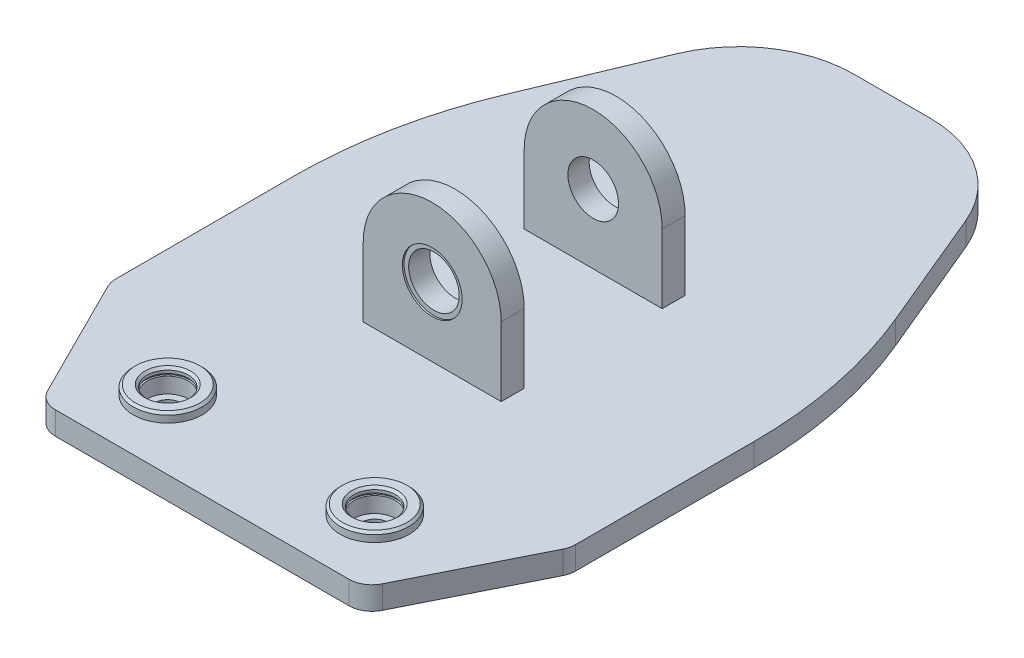
from build123d import *

# Parameters (mm, degrees)
EXTRUDE_1_DEPTH            = 10
EXTRUDE_START              = -100
EXTRUDE_3_DEPTH            = 80
SKETCH_5_W                 = 80
SKETCH_5_H                 = 60
CUT_EXTRUDE_2_DEPTH        = 110
FILLET_1_R                 = 50
FILLET_2_R                 = 200
SKETCH_7_R                 = 9
CUT_EXTRUDE_6_DEPTH        = 6
SKETCH_10_R                = 6
CUT_EXTRUDE_7_DEPTH        = 28
SKETCH_12_R                = 15
EXTRUDE_5_DEPTH            = 4
SKETCH_13_R                = 9
CUT_EXTRUDE_9_DEPTH        = 4
CUT_EXTRUDE_START          = -2.25
SKETCH_14_R                = 9.75
CUT_EXTRUDE_4141_DEPTH     = 1
CHAMFER_1_SIZE             = 1
CHAMFER_1_OF_MIRROR_1_SIZE = 1
SKETCH_16_R                = 13
CUT_EXTRUDE_10_DEPTH       = 0.75
CUT_EXTRUDE_START_2        = -0.75
SKETCH_17_R                = 13
CUT_EXTRUDE_11_DEPTH       = 0.75
CHAMFER_2_SIZE             = 30
CHAMFER_2_SIZE2            = 60
CHAMFER_3_SIZE             = 60
CHAMFER_3_SIZE2            = 30
FILLET_3_R                 = 10


with BuildPart() as part:
    # 草图1 → 凸台-拉伸1 (new body)
    with BuildSketch(Plane(origin=(0, 0, 0), x_dir=(1, 0, 0), z_dir=(0, 1, 0))):
        Polygon((-100, 0), (100, 0), (100, 180), (50, 300), (-50, 300), (-100, 180), align=None)
    extrude(amount=EXTRUDE_1_DEPTH)

    # 草图4 → 凸台-拉伸3 (add)
    with BuildSketch(Plane.XY.offset(EXTRUDE_START)):
        with BuildLine():
            Line((0, 29), (0, 10))
            Line((0, 10), (30, 10))
            Line((30, 10), (30, 40))
            ThreePointArc((30, 40), (21.213203436, 61.213203436), (0, 70))
            Line((0, 70), (0, 51))
            ThreePointArc((0, 51), (7.778174593, 47.778174593), (11, 40))
            ThreePointArc((11, 40), (7.778174593, 32.221825407), (0, 29))
        make_face()
        with BuildLine():
            Line((-30, 10), (0, 10))
            Line((0, 10), (0, 29))
            ThreePointArc((0, 29), (-11, 40), (0, 51))
            Line((0, 51), (0, 70))
            ThreePointArc((0, 70), (-21.213203436, 61.213203436), (-30, 40))
            Line((-30, 40), (-30, 10))
        make_face()
    extrude(amount=-EXTRUDE_3_DEPTH)

    # 草图5 → 切除-拉伸2 (cut)
    with BuildSketch(Plane(origin=(0, 10, 0), x_dir=(1, 0, 0), z_dir=(0, 1, 0))):
        with Locations((0, 140)):
            Rectangle(SKETCH_5_W, SKETCH_5_H)
    extrude(amount=CUT_EXTRUDE_2_DEPTH, mode=Mode.SUBTRACT)

    # 圆角1
    fillet_1_edges = [part.edges().sort_by_distance(p)[0] for p in [
        (-50, 5, -300),
        (50, 5, -300),
    ]]
    fillet(fillet_1_edges, radius=FILLET_1_R)

    # 圆角2
    fillet_2_edges = [part.edges().sort_by_distance(p)[0] for p in [
        (-100, 5, -180),
        (100, 5, -180),
    ]]
    fillet(fillet_2_edges, radius=FILLET_2_R)

    # 草图7 → 切除-拉伸6 (cut)
    with BuildSketch(Plane(origin=(0, 10, 0), x_dir=(1, 0, 0), z_dir=(0, 1, 0))):
        with Locations(Location((45, 30, 0), (0, 0, 270))):
            Circle(SKETCH_7_R)
    cut_extrude_6 = extrude(amount=-CUT_EXTRUDE_6_DEPTH, mode=Mode.SUBTRACT)

    # 草图10 → 切除-拉伸7 (cut)
    with BuildSketch(Plane(origin=(0, 4, 0), x_dir=(1, 0, 0), z_dir=(0, 1, 0))):
        with Locations(Location((45, 30, 0), (0, 0, 270))):
            Circle(SKETCH_10_R)
    cut_extrude_7 = extrude(amount=-CUT_EXTRUDE_7_DEPTH, mode=Mode.SUBTRACT)

    # 草图12 → 凸台-拉伸5 (add)
    with BuildSketch(Plane(origin=(0, 10, 0), x_dir=(1, 0, 0), z_dir=(0, 1, 0))):
        with Locations(Location((45, 30, 0), (0, 0, 270))):
            Circle(SKETCH_12_R)
    extrude_5 = extrude(amount=EXTRUDE_5_DEPTH)

    # 草图13 → 切除-拉伸9 (cut)
    with BuildSketch(Plane(origin=(0, 14, 0), x_dir=(1, 0, 0), z_dir=(0, 1, 0))):
        with Locations(Location((45, 30, 0), (0, 0, 270))):
            Circle(SKETCH_13_R)
    cut_extrude_9 = extrude(amount=-CUT_EXTRUDE_9_DEPTH, mode=Mode.SUBTRACT)

    # 草图14 → Cut-Extrude 4141 (cut)
    with BuildSketch(Plane(origin=(0, 14, 0), x_dir=(1, 0, 0), z_dir=(0, 1, 0)).offset(CUT_EXTRUDE_START)):
        with Locations(Location((45, 30, 0), (0, 0, 270))):
            Circle(SKETCH_14_R)
    cut_extrude_4141 = extrude(amount=-CUT_EXTRUDE_4141_DEPTH, mode=Mode.SUBTRACT)

    # 倒角1
    chamfer_1_edges = [part.edges().sort_by_distance(p)[0] for p in [
        (45, 14, -45),
        (45, 14, -39),
    ]]
    chamfer(chamfer_1_edges, length=CHAMFER_1_SIZE)

    # 镜向1: 切除-拉伸6, 切除-拉伸7, 凸台-拉伸5, 切除-拉伸9, Cut-Extrude 4141 across plane
    add(cut_extrude_6.mirror(Plane.ZY), mode=Mode.SUBTRACT)
    add(cut_extrude_7.mirror(Plane.ZY), mode=Mode.SUBTRACT)
    add(extrude_5.mirror(Plane.ZY))
    add(cut_extrude_9.mirror(Plane.ZY), mode=Mode.SUBTRACT)
    add(cut_extrude_4141.mirror(Plane.ZY), mode=Mode.SUBTRACT)

    # 倒角1 of 镜向1
    chamfer_1_of_mirror_1_edges = [part.edges().sort_by_distance(p)[0] for p in [
        (-45, 14, -45),
        (-45, 14, -39),
    ]]
    chamfer(chamfer_1_of_mirror_1_edges, length=CHAMFER_1_OF_MIRROR_1_SIZE)

    # 草图16 → 切除-拉伸10 (cut)
    with BuildSketch(Plane.XY.offset(-100)):
        with Locations((0, 40)):
            Circle(SKETCH_16_R)
    extrude(amount=-CUT_EXTRUDE_10_DEPTH, mode=Mode.SUBTRACT)

    # 草图17 → 切除-拉伸11 (cut)
    with BuildSketch(Plane(origin=(0, 0, -180), x_dir=(-1, 0, 0), z_dir=(0, 0, -1)).offset(CUT_EXTRUDE_START_2)):
        with Locations(Location((0, 40, 0), (0, 0, 180))):
            Circle(SKETCH_17_R)
    extrude(amount=CUT_EXTRUDE_11_DEPTH, mode=Mode.SUBTRACT)

    # 倒角2
    chamfer_2_edges = [part.edges().sort_by_distance(p)[0] for p in [
        (100, 5, 0),
    ]]
    chamfer_2_side = [part.faces().sort_by_distance(p)[0] for p in [
        (0, 5, 0),
    ]]
    chamfer(chamfer_2_edges, length=CHAMFER_2_SIZE, length2=CHAMFER_2_SIZE2, reference=chamfer_2_side[0])

    # 倒角3
    chamfer_3_edges = [part.edges().sort_by_distance(p)[0] for p in [
        (-100, 5, 0),
    ]]
    chamfer_3_side = [part.faces().sort_by_distance(p)[0] for p in [
        (-100, 5, -70),
    ]]
    chamfer(chamfer_3_edges, length=CHAMFER_3_SIZE, length2=CHAMFER_3_SIZE2, reference=chamfer_3_side[0])

    # 圆角3
    fillet_3_edges = [part.edges().sort_by_distance(p)[0] for p in [
        (100, 5, -60),
        (70, 5, 0),
        (-70, 5, 0),
        (-100, 5, -60),
    ]]
    fillet(fillet_3_edges, radius=FILLET_3_R)


solid = part.part
